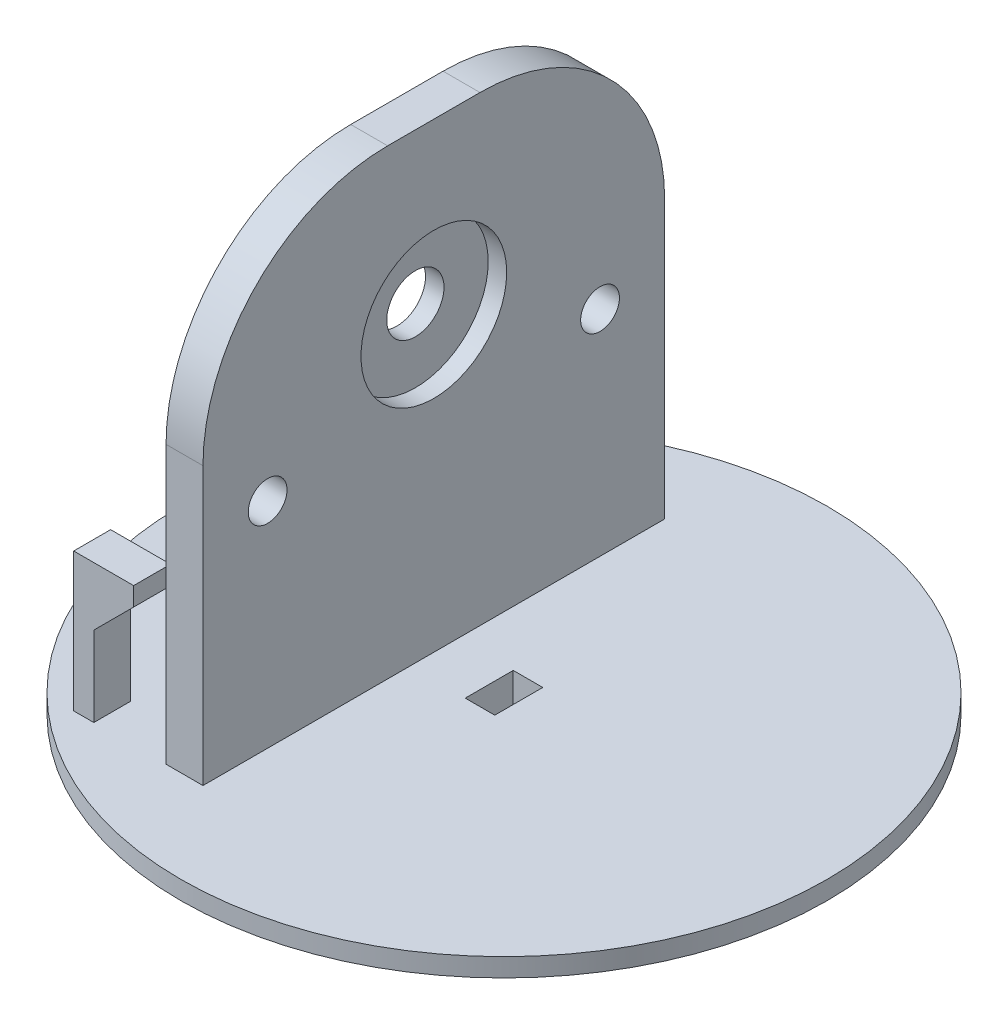
from build123d import *

# Parameters (mm, degrees)
SKETCH1_R           = 35
SKETCH1_W           = 3.2
SKETCH1_H           = 5.2
BOSS_EXTRUDE1_DEPTH = 2
SKETCH2_W           = 7.2
SKETCH2_H           = 9.2
SKETCH2_W_2         = 3.2
SKETCH2_H_2         = 5.2
BOSS_EXTRUDE2_DEPTH = 3
SKETCH3_W           = 4
SKETCH3_H           = 50
BOSS_EXTRUDE3_DEPTH = 50
SKETCH4_R           = 3.1
SKETCH4_R_2         = 2.1
CUT_EXTRUDE1_DEPTH  = 50
FILLET1_R           = 20
SKETCH6_W           = 10
SKETCH6_H           = 4
BOSS_EXTRUDE4_DEPTH = 15
CUT_EXTRUDE2_DEPTH  = 15
SKETCH8_R           = 7.889109842
CUT_EXTRUDE3_DEPTH  = 2
SKETCH9_R           = 10
SKETCH9_W           = 7.2
SKETCH9_H           = 9.2
BOSS_EXTRUDE5_DEPTH = 3


with BuildPart() as part:
    # Sketch1 → Boss-Extrude1 (new body)
    with BuildSketch(Plane(origin=(0, 0, 0), x_dir=(1, 0, 0), z_dir=(0, 1, 0))):
        with Locations(Location((0, 0, 0), (0, 0, 270))):
            Circle(SKETCH1_R)
        Rectangle(SKETCH1_W, SKETCH1_H, mode=Mode.SUBTRACT)
    extrude(amount=BOSS_EXTRUDE1_DEPTH)

    # Sketch2 → Boss-Extrude2 (add)
    with BuildSketch(Plane.XZ):
        Rectangle(SKETCH2_W, SKETCH2_H)
        Rectangle(SKETCH2_W_2, SKETCH2_H_2, mode=Mode.SUBTRACT)
    extrude(amount=BOSS_EXTRUDE2_DEPTH)

    # Sketch3 → Boss-Extrude3 (add)
    with BuildSketch(Plane(origin=(0, 2, 0), x_dir=(1, 0, 0), z_dir=(0, 1, 0))):
        with Locations((-9.6, 0)):
            Rectangle(SKETCH3_W, SKETCH3_H)
    extrude(amount=BOSS_EXTRUDE3_DEPTH)

    # Sketch4 → Cut-Extrude1 (cut)
    with BuildSketch(Plane(origin=(-7.6, 0, 0), x_dir=(0, 0, -1), z_dir=(1, 0, 0))):
        with Locations((0, 33.691273446)):
            Circle(SKETCH4_R)
        with Locations((-18, 25.191273446)):
            Circle(SKETCH4_R_2)
        with Locations((18, 25.191273446)):
            Circle(SKETCH4_R_2)
    extrude(amount=-CUT_EXTRUDE1_DEPTH, mode=Mode.SUBTRACT)

    # Fillet1
    fillet1_edges = [part.edges().sort_by_distance(p)[0] for p in [
        (-9.6, 52, 25),
        (-9.6, 52, -25),
    ]]
    fillet(fillet1_edges, radius=FILLET1_R)

    # Sketch6 → Boss-Extrude4 (add)
    with BuildSketch(Plane(origin=(0, 2, 0), x_dir=(1, 0, 0), z_dir=(0, 1, 0))):
        with Locations((-16.6, -23)):
            Rectangle(SKETCH6_W, SKETCH6_H)
    extrude(amount=BOSS_EXTRUDE4_DEPTH)

    # Sketch7 → Cut-Extrude2 (cut)
    with BuildSketch(Plane.XY.offset(25)):
        Polygon((-11.6, 2), (-11.6, 17), (-15.110464725, 17), (-15.110464725, 14.98052876), (-19.421422774, 10.669570711), (-19.421422774, 2), align=None)
    extrude(amount=-CUT_EXTRUDE2_DEPTH, mode=Mode.SUBTRACT)

    # Sketch8 → Cut-Extrude3 (cut)
    with BuildSketch(Plane(origin=(-7.6, 0, 0), x_dir=(0, 0, -1), z_dir=(1, 0, 0))):
        with Locations((0, 33.691273446)):
            Circle(SKETCH8_R)
    extrude(amount=-CUT_EXTRUDE3_DEPTH, mode=Mode.SUBTRACT)

    # Sketch9 → Boss-Extrude5 (add)
    with BuildSketch(Plane.XZ.offset(3)):
        with Locations(Location((0, 0, 0), (0, 0, 270))):
            Circle(SKETCH9_R)
        Rectangle(SKETCH9_W, SKETCH9_H, mode=Mode.SUBTRACT)
    extrude(amount=-BOSS_EXTRUDE5_DEPTH)


solid = part.part
